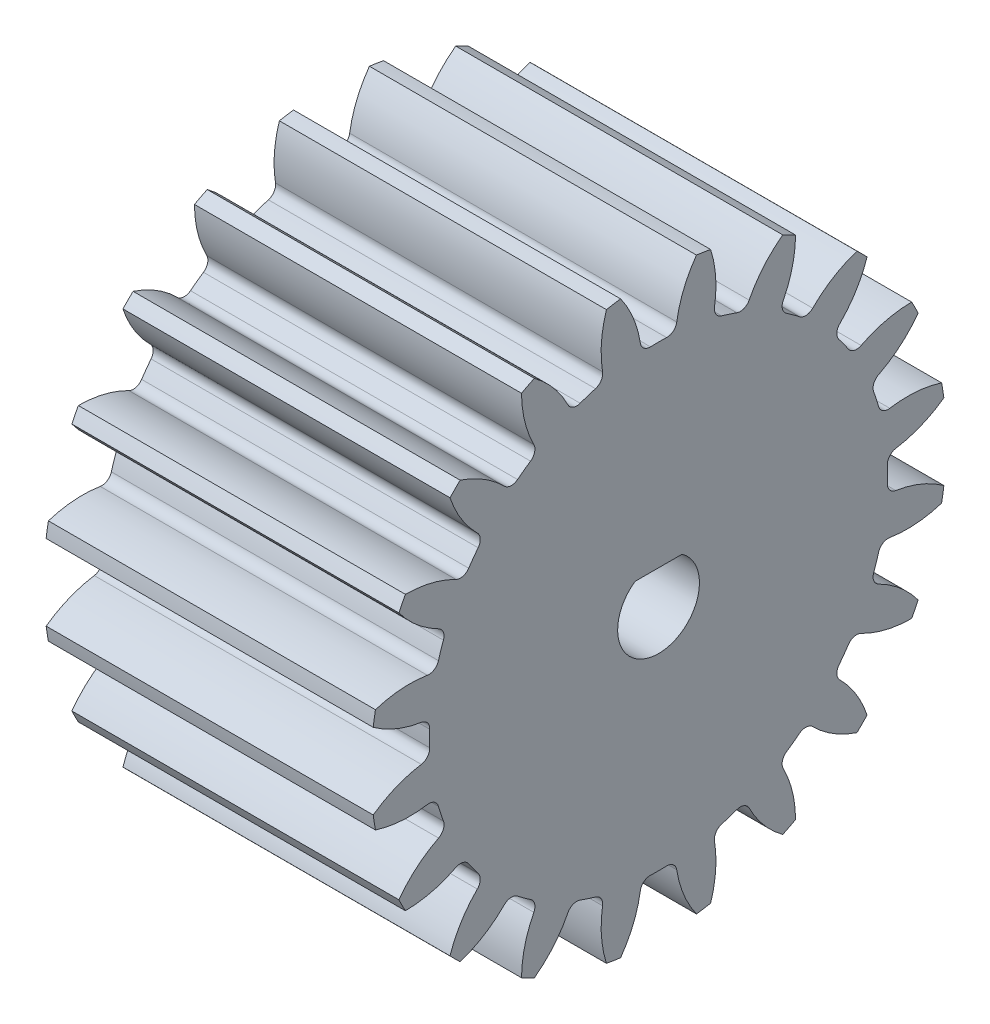
from build123d import *

# Parameters (mm, degrees)
SKETCH1_R                = 22
SKETCH1_R_2              = 3.125
BOSS_EXTRUDE2_DEPTH      = 25
CUT_EXTRUDE1_DEPTH       = 40.912404087
FILLET1_R                = 0.76
CIRPATTERN2_COUNT        = 20
FILLET1_OF_CIRPATTERN2_R = 0.76
BOSS_EXTRUDE3_DEPTH      = 25


with BuildPart() as part:
    # Sketch1 → Boss-Extrude2 (new body)
    with BuildSketch(Plane(origin=(0, 0, 0), x_dir=(0, 0, -1), z_dir=(1, 0, 0))):
        Circle(SKETCH1_R)
        Circle(SKETCH1_R_2, mode=Mode.SUBTRACT)
    extrude(amount=BOSS_EXTRUDE2_DEPTH)

    # Sketch3 → Cut-Extrude1 (cut, through all)
    with BuildSketch(Plane(origin=(25, 0, 0), x_dir=(0, 0, -1), z_dir=(1, 0, 0))):
        with BuildLine():
            ThreePointArc((1.312834539, 17.450686676), (0, 17.5), (-1.312834539, 17.450686676))
            ThreePointArc((-1.312834539, 17.450686676), (-1.80549018, 19.738750047), (-2.898832849, 21.80818122))
            ThreePointArc((-2.898832849, 21.80818122), (0, 22), (2.898832849, 21.80818122))
            ThreePointArc((2.898832849, 21.80818122), (1.80549018, 19.738750047), (1.312834539, 17.450686676))
        make_face()
    cut_extrude1 = extrude(amount=-CUT_EXTRUDE1_DEPTH, mode=Mode.SUBTRACT)

    # Fillet1
    fillet1_edges = [part.edges().sort_by_distance(p)[0] for p in [
        (12.5, 17.450686676, 1.312834539),
        (12.5, 17.450686676, -1.312834539),
    ]]
    fillet(fillet1_edges, radius=FILLET1_R)

    # CirPattern2: Cut-Extrude1 ×20 about axis
    cirpattern2_axis = Axis((0, 0, 0), (1, 0, 0))
    for i in range(1, CIRPATTERN2_COUNT):
        add(cut_extrude1.rotate(cirpattern2_axis, i * 360 / CIRPATTERN2_COUNT), mode=Mode.SUBTRACT)

    # Fillet1 of CirPattern2
    fillet1_of_cirpattern2_edges = [part.edges().sort_by_distance(p)[0] for p in [
        (12.5, 16.190901094, 6.64113859),
        (12.5, 17.002277461, 4.143978903),
        (12.5, 13.346237304, 11.319361724),
        (12.5, 14.889566866, 9.195150817),
        (12.5, 9.195150817, 14.889566866),
        (12.5, 11.319361724, 13.346237304),
        (12.5, 4.143978903, 17.002277461),
        (12.5, 6.64113859, 16.190901094),
        (12.5, -1.312834539, 17.450686676),
        (12.5, 1.312834539, 17.450686676),
        (12.5, -6.64113859, 16.190901094),
        (12.5, -4.143978903, 17.002277461),
        (12.5, -11.319361724, 13.346237304),
        (12.5, -9.195150817, 14.889566866),
        (12.5, -14.889566866, 9.195150817),
        (12.5, -13.346237304, 11.319361724),
        (12.5, -17.002277461, 4.143978903),
        (12.5, -16.190901094, 6.64113859),
        (12.5, -17.450686676, -1.312834539),
        (12.5, -17.450686676, 1.312834539),
        (12.5, -16.190901094, -6.64113859),
        (12.5, -17.002277461, -4.143978903),
        (12.5, -13.346237304, -11.319361724),
        (12.5, -14.889566866, -9.195150817),
        (12.5, -9.195150817, -14.889566866),
        (12.5, -11.319361724, -13.346237304),
        (12.5, -4.143978903, -17.002277461),
        (12.5, -6.64113859, -16.190901094),
        (12.5, 1.312834539, -17.450686676),
        (12.5, -1.312834539, -17.450686676),
        (12.5, 6.64113859, -16.190901094),
        (12.5, 4.143978903, -17.002277461),
        (12.5, 11.319361724, -13.346237304),
        (12.5, 9.195150817, -14.889566866),
        (12.5, 14.889566866, -9.195150817),
        (12.5, 13.346237304, -11.319361724),
        (12.5, 17.002277461, -4.143978903),
        (12.5, 16.190901094, -6.64113859),
    ]]
    fillet(fillet1_of_cirpattern2_edges, radius=FILLET1_OF_CIRPATTERN2_R)

    # Sketch4 → Boss-Extrude3 (add)
    with BuildSketch(Plane.ZY):
        with BuildLine():
            Line((-1.8, 2.55453029), (1.8, 2.55453029))
            ThreePointArc((1.8, 2.55453029), (0, 3.15453029), (-1.8, 2.55453029))
        make_face()
    extrude(amount=-BOSS_EXTRUDE3_DEPTH)


solid = part.part
